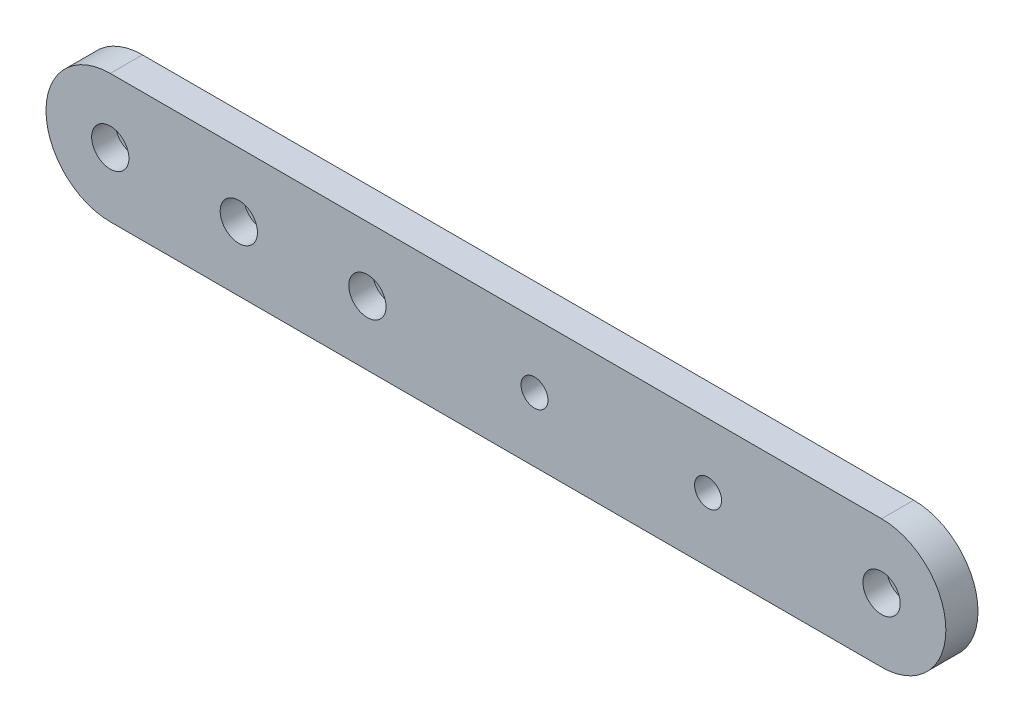
from build123d import *

# Parameters (mm, degrees)
ESQUISSE1_R             = 1.5
EXTRUSION1_DEPTH        = 5
ESQUISSE2_R             = 2.9
ENL_V_MAT_EXTRU_1_DEPTH = 71.807414866
ESQUISSE3_R             = 2.1
ENL_V_MAT_EXTRU_2_DEPTH = 71.887234394


with BuildPart() as part:
    # Esquisse1 → Extrusion1 (new body)
    with BuildSketch(Plane.XY):
        with BuildLine():
            Line((-60, 10), (60, 10))
            ThreePointArc((60, 10), (70, 0), (60, -10))
            Line((60, -10), (-60, -10))
            ThreePointArc((-60, -10), (-70, 0), (-60, 10))
        make_face()
        with Locations((-40, 0)):
            Circle(ESQUISSE1_R, mode=Mode.SUBTRACT)
        with Locations((-20, 0)):
            Circle(ESQUISSE1_R, mode=Mode.SUBTRACT)
        with Locations((-60, 0)):
            Circle(ESQUISSE1_R, mode=Mode.SUBTRACT)
        with Locations((60, 0)):
            Circle(ESQUISSE1_R, mode=Mode.SUBTRACT)
    extrude(amount=EXTRUSION1_DEPTH)

    # Esquisse2 → Enlèv. mat.-Extru.1 (cut, through all)
    with BuildSketch(Plane(origin=(0, 0, 1.3), x_dir=(-1, 0, 0), z_dir=(0, 0, -1))):
        with Locations((-60, 0)):
            Circle(ESQUISSE2_R)
        with Locations((60, 0)):
            Circle(ESQUISSE2_R)
        with Locations((20, 0)):
            Circle(ESQUISSE2_R)
        with Locations((40, 0)):
            Circle(ESQUISSE2_R)
    extrude(amount=-ENL_V_MAT_EXTRU_1_DEPTH, mode=Mode.SUBTRACT)

    # Esquisse3 → Enlèv. mat.-Extru.2 (cut, through all)
    with BuildSketch(Plane(origin=(0, 0, 0), x_dir=(-1, 0, 0), z_dir=(0, 0, -1))):
        with Locations((-6, 0)):
            Circle(ESQUISSE3_R)
        with Locations((-33, 0)):
            Circle(ESQUISSE3_R)
    extrude(amount=-ENL_V_MAT_EXTRU_2_DEPTH, mode=Mode.SUBTRACT)


solid = part.part
